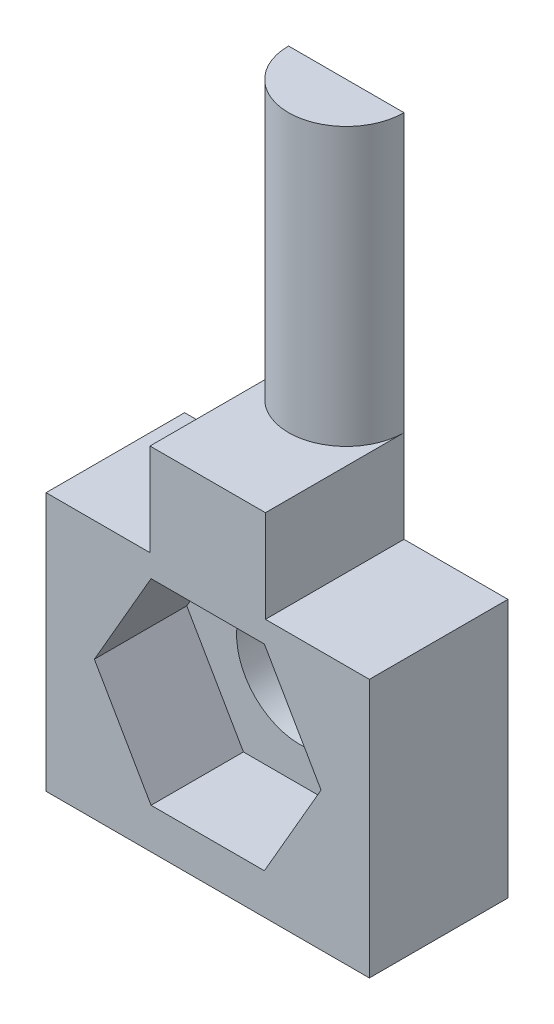
from build123d import *

# Parameters (mm, degrees)
CROQUIS1_R              = 2.75
SALIENTE_EXTRUIR1_DEPTH = 6
SALIENTE_EXTRUIR2_DEPTH = 12
CORTAR_EXTRUIR1_DEPTH   = 4


with BuildPart() as part:
    # Croquis1 → Saliente-Extruir1 (new body)
    with BuildSketch(Plane.XY):
        Polygon((-9.5, 11.2), (-14, 11.2), (-14, 0), (0, 0), (0, 11.2), (-4.5, 11.2), (-4.5, 15.2), (-9.5, 15.2), align=None)
        with Locations((-7, 6)):
            Circle(CROQUIS1_R, mode=Mode.SUBTRACT)
    extrude(amount=SALIENTE_EXTRUIR1_DEPTH)

    # Croquis2 → Saliente-Extruir2 (add)
    with BuildSketch(Plane(origin=(0, 15.2, 0), x_dir=(1, 0, 0), z_dir=(0, 1, 0))):
        with BuildLine():
            Line((-9.5, 0), (-4.5, 0))
            ThreePointArc((-4.5, 0), (-7, -2.5), (-9.5, 0))
        make_face()
    extrude(amount=SALIENTE_EXTRUIR2_DEPTH)

    # Croquis3 → Cortar-Extruir1 (cut)
    with BuildSketch(Plane.XY.offset(6)):
        Polygon((-2.092522712, 6), (-4.546261356, 10.25), (-9.453738644, 10.25), (-11.907477288, 6), (-9.453738644, 1.75), (-4.546261356, 1.75), align=None)
    extrude(amount=-CORTAR_EXTRUIR1_DEPTH, mode=Mode.SUBTRACT)


solid = part.part
